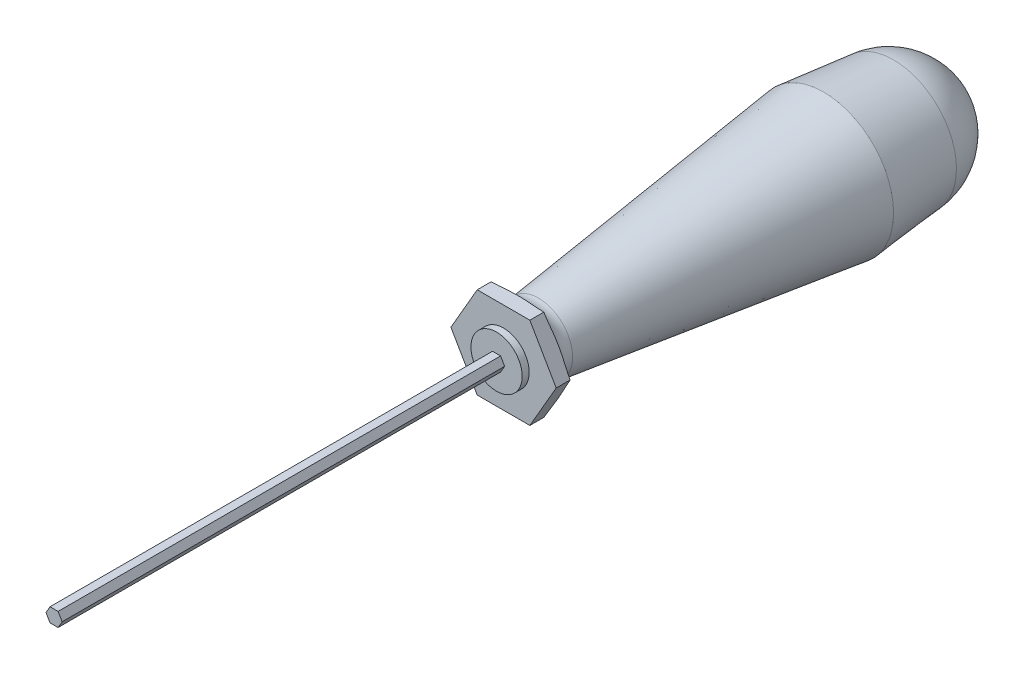
from build123d import *

# Parameters (mm, degrees)
SALIENTE_EXTRUIR1_DEPTH = 120
CROQUIS4_OUTSIDE_W      = 71.568
CROQUIS4_OUTSIDE_H      = 71.568
CORTAR_EXTRUIR4_DEPTH   = 4


with BuildPart() as part:
    # Croquis1 → Saliente-Extruir1 (new body)
    with BuildSketch(Plane.XY):
        Polygon((1.732050808, 0), (0.866025404, 1.5), (-0.866025404, 1.5), (-1.732050808, 0), (-0.866025404, -1.5), (0.866025404, -1.5), align=None)
    extrude(amount=-SALIENTE_EXTRUIR1_DEPTH)

    # Croquis2 → Revolución1 (revolve)
    with BuildSketch(Plane(origin=(0, 0, 0), x_dir=(0, 0, -1), z_dir=(1, 0, 0)), mode=Mode.PRIVATE) as revoluci_n1_sk:
        with BuildLine():
            Line((95, 0), (95, 5.5))
            Line((95, 5.5), (96.5, 5.5))
            Line((96.5, 5.5), (96.5, 11.302416344))
            Line((96.5, 11.302416344), (99.5, 11.302416344))
            ThreePointArc((99.5, 11.302416344), (100.853065576, 8.303460166), (103.996869078, 7.333396173))
            Line((103.996869078, 7.333396173), (165.238162917, 15))
            Line((165.238162917, 15), (180.238162917, 13.5))
            ThreePointArc((180.238162917, 13.5), (189.219695312, 9.139623787), (193.238162917, 0))
            Line((193.238162917, 0), (95, 0))
        make_face()
    revolve(revoluci_n1_sk.sketch.rotate(Axis((0, 0, 0), (0, 0, -1)), 90), axis=Axis((0, 0, 0), (0, 0, -1)))

    # Croquis4 outside → Cortar-Extruir4 (cut)
    with BuildSketch(Plane.XY.offset(-96.5)):
        Rectangle(CROQUIS4_OUTSIDE_W, CROQUIS4_OUTSIDE_H)
        Polygon((11.302416344, 0), (5.651208172, 9.788179678), (-5.651208172, 9.788179678), (-11.302416344, 0), (-5.651208172, -9.788179678), (5.651208172, -9.788179678), align=None, mode=Mode.SUBTRACT)
    extrude(amount=-CORTAR_EXTRUIR4_DEPTH, mode=Mode.SUBTRACT)


solid = part.part
